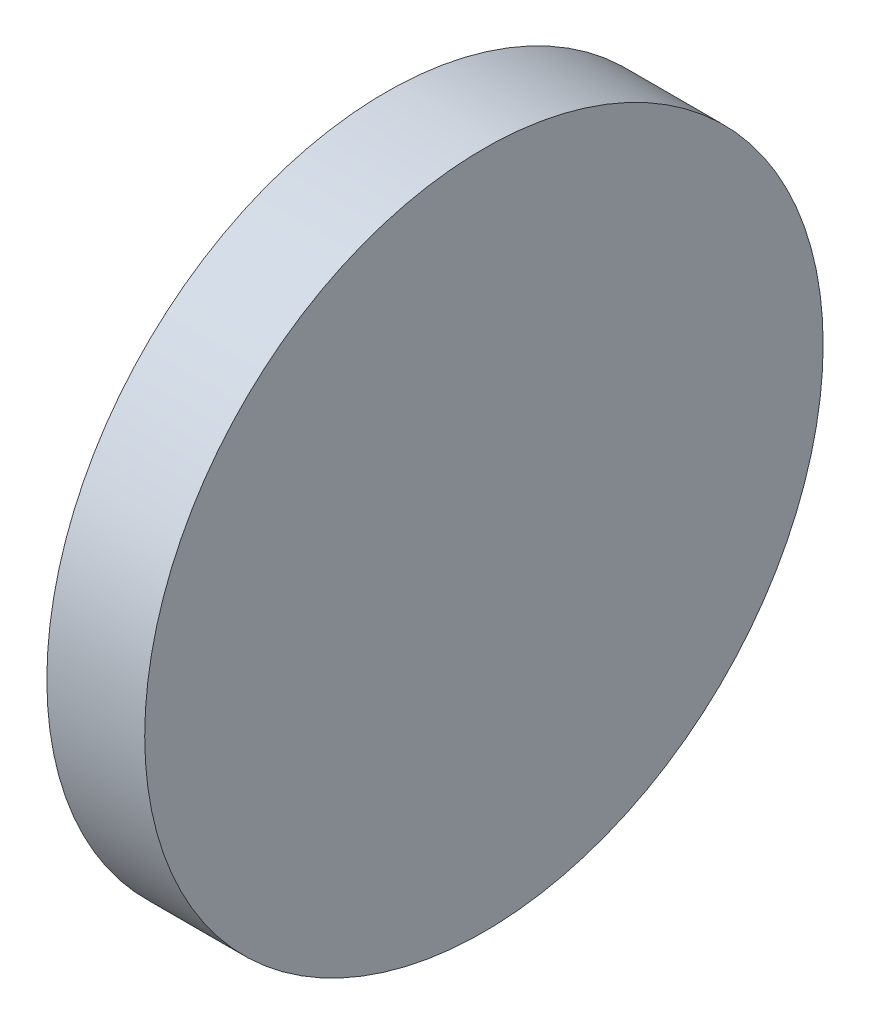
from build123d import *

# Parameters (mm, degrees)
SKETCH_1_W = 15
SKETCH_1_H = 52


with BuildPart() as part:
    # ｽｹｯﾁ1 → Revolve 309 (revolve)
    with BuildSketch(Plane.XY, mode=Mode.PRIVATE) as revolve_309_sk:
        with Locations((7.5, 26)):
            Rectangle(SKETCH_1_W, SKETCH_1_H)
    revolve(revolve_309_sk.sketch.rotate(Axis((0, 0, 0), (1, 0, 0)), 90), axis=Axis((0, 0, 0), (1, 0, 0)))


solid = part.part
